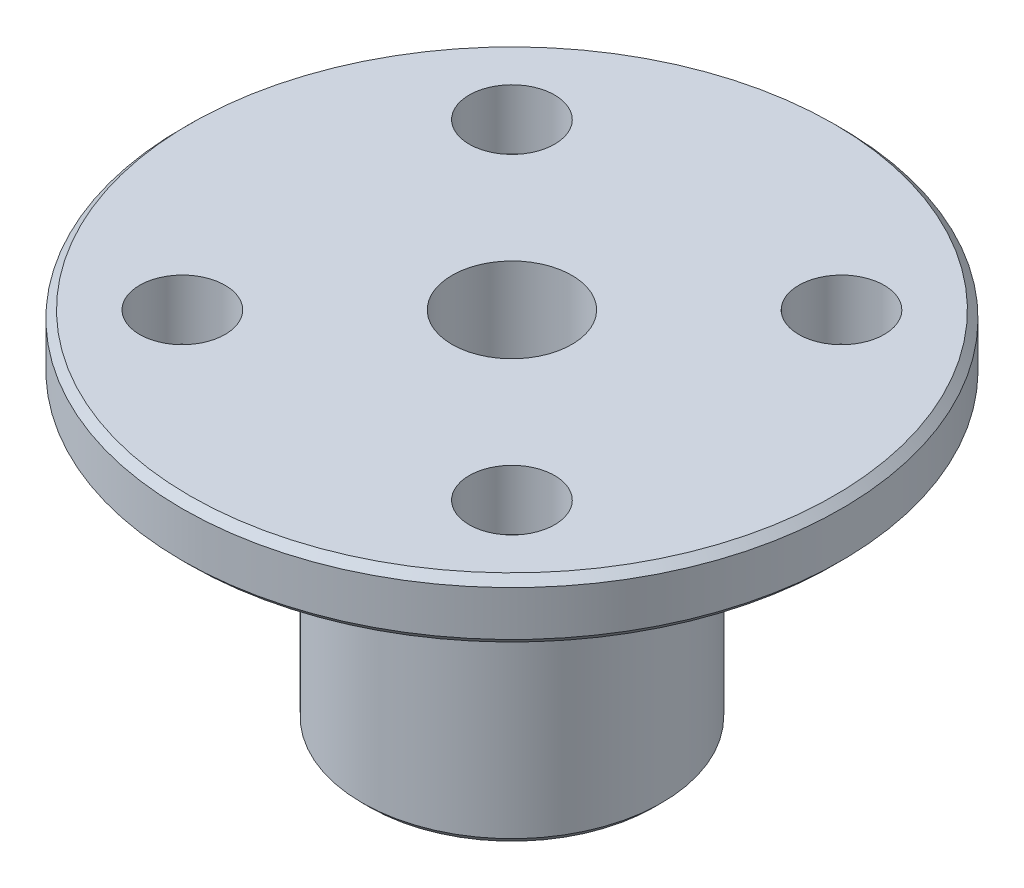
from build123d import *

# Parameters (mm, degrees)
SKETCH1_R           = 11
SKETCH1_R_2         = 1.425
SKETCH1_R_3         = 2
BOSS_EXTRUDE1_DEPTH = 2
SKETCH1_3_R         = 5
SKETCH1_3_R_2       = 2
BOSS_EXTRUDE2_DEPTH = 12
CHAMFER1_SIZE       = 0.25


with BuildPart() as part:
    # Sketch1 → Boss-Extrude1 (new body)
    with BuildSketch(Plane(origin=(0, 0, 0), x_dir=(1, 0, 0), z_dir=(0, 1, 0))):
        Circle(SKETCH1_R)
        with Locations((5.5, 5.5)):
            Circle(SKETCH1_R_2, mode=Mode.SUBTRACT)
        with Locations((5.5, -5.5)):
            Circle(SKETCH1_R_2, mode=Mode.SUBTRACT)
        with Locations((-5.5, -5.5)):
            Circle(SKETCH1_R_2, mode=Mode.SUBTRACT)
        with Locations((-5.5, 5.5)):
            Circle(SKETCH1_R_2, mode=Mode.SUBTRACT)
        Circle(SKETCH1_R_3, mode=Mode.SUBTRACT)
    extrude(amount=-BOSS_EXTRUDE1_DEPTH)

    # Sketch1<3> → Boss-Extrude2 (add)
    with BuildSketch(Plane(origin=(0, 0, 0), x_dir=(1, 0, 0), z_dir=(0, 1, 0))):
        Circle(SKETCH1_3_R)
        Circle(SKETCH1_3_R_2, mode=Mode.SUBTRACT)
    extrude(amount=-BOSS_EXTRUDE2_DEPTH)

    # Chamfer1
    chamfer1_edges = [part.edges().sort_by_distance(p)[0] for p in [
        (-2, -12, 0),
        (-5, -2, 0),
        (-5, -12, 0),
        (-11, -2, 0),
        (-11, 0, 0),
    ]]
    chamfer(chamfer1_edges, length=CHAMFER1_SIZE)


solid = part.part
